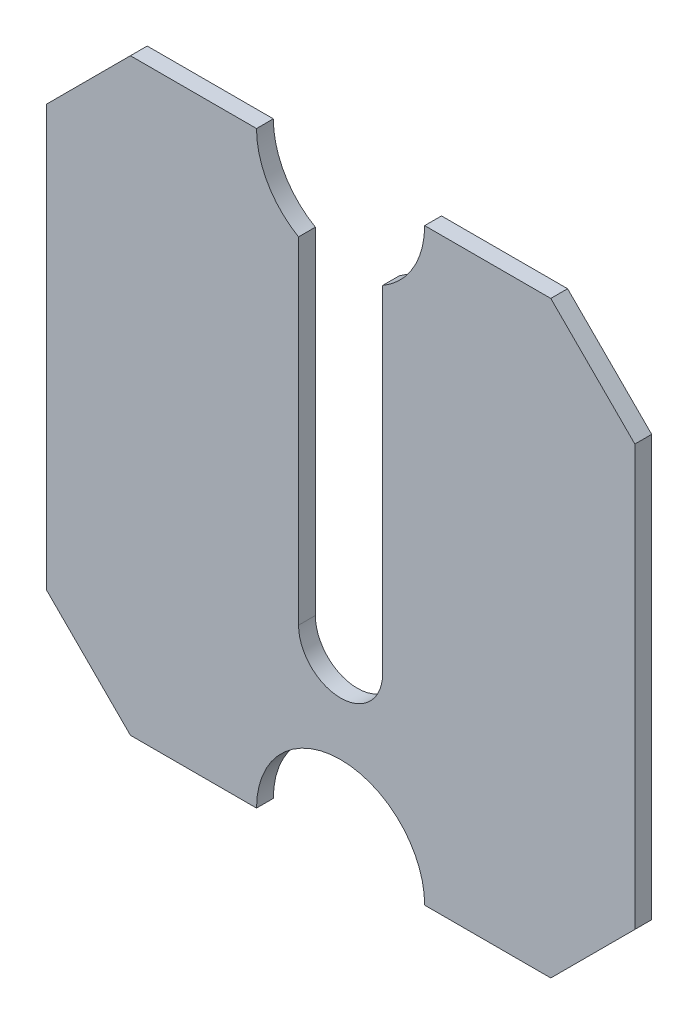
from build123d import *

# Parameters (mm, degrees)
BOSS_EXTRUDE1_DEPTH = 10


with BuildPart() as part:
    # Sketch1 → Boss-Extrude1 (new body)
    with BuildSketch(Plane.XY):
        with BuildLine():
            Line((125, 175), (50, 175))
            ThreePointArc((50, 175), (43.301270189, 150), (25, 131.698729811))
            Line((25, 131.698729811), (25, -68.301270189))
            ThreePointArc((25, -68.301270189), (0, -93.301270189), (-25, -68.301270189))
            Line((-25, -68.301270189), (-25, 131.698729811))
            ThreePointArc((-25, 131.698729811), (-43.301270189, 150), (-50, 175))
            Line((-50, 175), (-125, 175))
            Line((-125, 175), (-175, 125))
            Line((-175, 125), (-175, -125))
            Line((-175, -125), (-125, -175))
            Line((-125, -175), (-50, -175))
            ThreePointArc((-50, -175), (0, -125), (50, -175))
            Line((50, -175), (125, -175))
            Line((125, -175), (175, -125))
            Line((175, -125), (175, 125))
            Line((175, 125), (125, 175))
        make_face()
    extrude(amount=BOSS_EXTRUDE1_DEPTH)


solid = part.part
